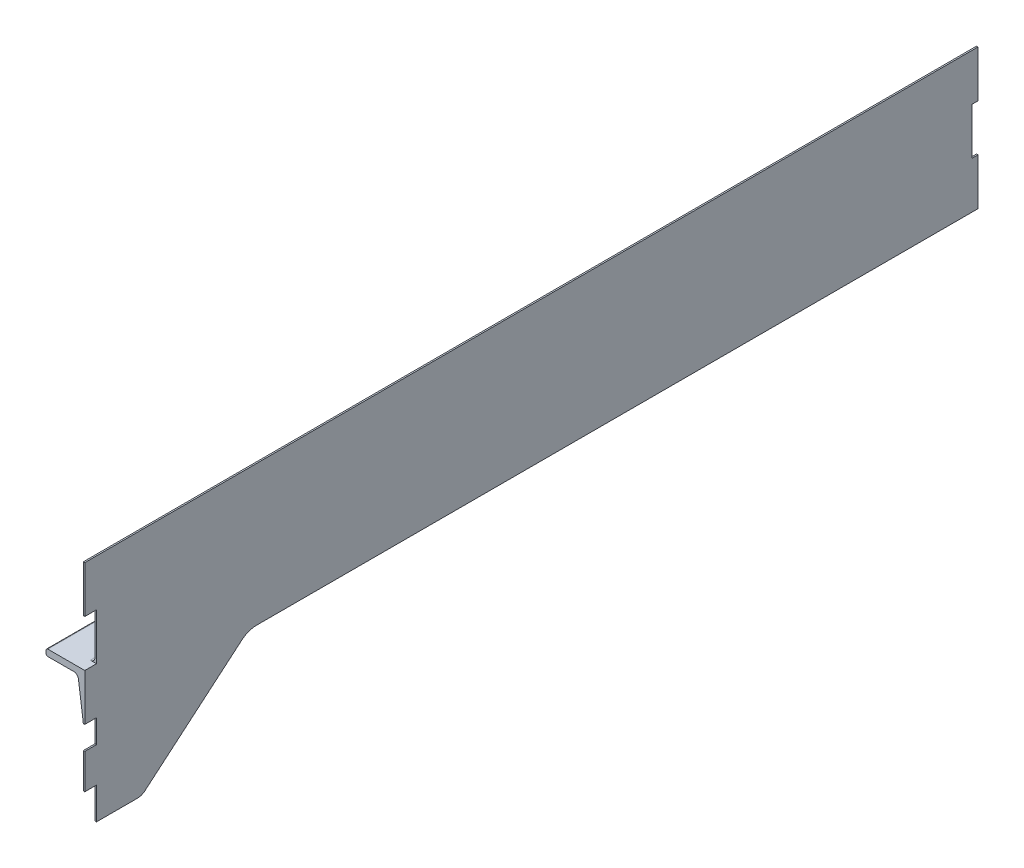
from build123d import *

# Parameters (mm, degrees)
BOSS_EXTRUDE1_DEPTH = 0.79375
BOSS_EXTRUDE2_DEPTH = 482.6
SKETCH5_W           = 30.221142114
SKETCH5_H           = 4.701476641
CUT_EXTRUDE1_DEPTH  = 27.94


with BuildPart() as part:
    # Sketch1 → Boss-Extrude1 (new body)
    with BuildSketch(Plane(origin=(-94.488, 0, 0), x_dir=(0, -1, 0), z_dir=(-1, 0, 0))):
        Polygon((111.125, -196.85), (111.125, -203.2), (85.725, -203.2), (85.725, -196.85), (60.325, -196.85), (60.325, -682.625), (85.725, -682.625), (85.725, -679.45), (111.125, -679.45), (111.125, -682.625), (136.525, -682.625), (136.525, -290.406498707), (136.525, -203.2), (136.525, -196.85), align=None)
        with BuildLine():
            Line((149.225, -203.2), (136.525, -203.2))
            Line((136.525, -203.2), (136.525, -290.406498707))
            ThreePointArc((136.525, -290.406498707), (137.30121982, -286.034603668), (139.534994681, -282.197126202))
            Line((139.534994681, -282.197126202), (184.118202659, -229.57294303))
            ThreePointArc((184.118202659, -229.57294303), (185.23509009, -227.654204297), (185.6232, -225.468256778))
            Line((185.6232, -225.468256778), (185.6232, -203.2))
            Line((185.6232, -203.2), (168.275, -203.2))
            Line((168.275, -203.2), (168.275, -196.85))
            Line((168.275, -196.85), (149.225, -196.85))
            Line((149.225, -196.85), (149.225, -203.2))
        make_face()
    extrude(amount=-BOSS_EXTRUDE1_DEPTH)

    # Sketch4 → Boss-Extrude2 (add)
    with BuildSketch(Plane(origin=(0, 0, -679.45), x_dir=(-1, 0, 0), z_dir=(0, 0, -1))):
        with BuildLine():
            Line((97.166105032, -116.822884411), (94.488, -136.525))
            Line((94.488, -136.525), (94.488, -114.25313135))
            Line((94.488, -114.25313135), (94.488, -111.125))
            Line((94.488, -111.125), (94.488, -108.585))
            ThreePointArc((94.488, -108.585), (95.231948776, -110.381051224), (97.028, -111.125))
            Line((97.028, -111.125), (113.793536469, -111.125))
            ThreePointArc((113.793536469, -111.125), (114.50064325, -111.417893219), (114.793536469, -112.125))
            Line((114.793536469, -112.125), (114.793536469, -113.625))
            ThreePointArc((114.793536469, -113.625), (114.50064325, -114.332106781), (113.793536469, -114.625))
            Line((113.793536469, -114.625), (99.682959601, -114.625))
            ThreePointArc((99.682959601, -114.625), (98.012237242, -115.251812399), (97.166105032, -116.822884411))
        make_face()
    extrude(amount=-BOSS_EXTRUDE2_DEPTH)

    # Sketch5 → Cut-Extrude1 (cut)
    with BuildSketch(Plane(origin=(-93.69425, 0, 0), x_dir=(0, 0, -1), z_dir=(1, 0, 0))):
        with Locations((188.089428943, -108.77426168)):
            Rectangle(SKETCH5_W, SKETCH5_H)
    extrude(amount=-CUT_EXTRUDE1_DEPTH, mode=Mode.SUBTRACT)


solid = part.part
